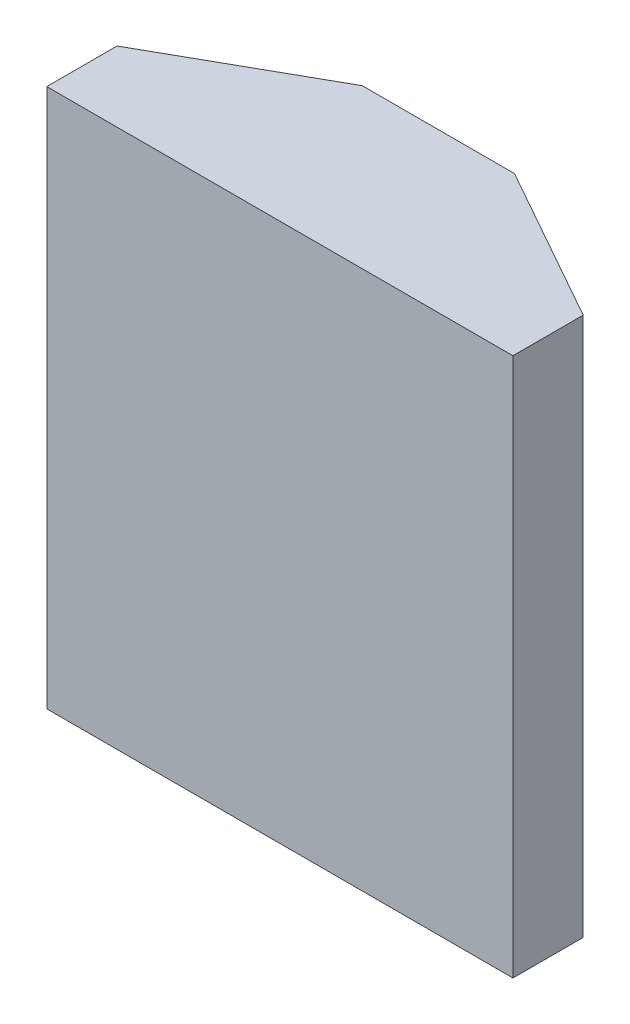
from build123d import *

# Parameters (mm, degrees)
BOSS_EXTRUDE1_DEPTH = 46
CUT_EXTRUDE1_START  = -1
CUT_EXTRUDE1_DEPTH  = 44
CUT_EXTRUDE2_REACH  = 53.912


with BuildPart() as part:
    # Sketch1 → Boss-Extrude1 (new body)
    with BuildSketch(Plane(origin=(0, 0, 0), x_dir=(1, 0, 0), z_dir=(0, 1, 0))):
        Polygon((-19.895, 0), (19.895, 0), (19.895, 6), (6.5, 13.53), (-6.5, 13.53), (-19.895, 6), align=None)
    extrude(amount=BOSS_EXTRUDE1_DEPTH)

    # Sketch2 → Cut-Extrude1 (cut)
    with BuildSketch(Plane(origin=(0, 46, 0), x_dir=(1, 0, 0), z_dir=(0, 1, 0)).offset(CUT_EXTRUDE1_START)):
        Polygon((18.895, 5.414974095), (6.23819097, 12.53), (-6.23819097, 12.53), (-18.895, 5.414974095), (-18.895, 1), (18.895, 1), align=None)
    extrude(amount=-CUT_EXTRUDE1_DEPTH, mode=Mode.SUBTRACT)

    # Sketch3 → Cut-Extrude2 (cut, up to next)
    with BuildSketch(Plane.XZ, mode=Mode.PRIVATE) as cut_extrude2_sk1:
        with BuildLine():
            Line((-2.89, -9.97), (2.89, -9.97))
            ThreePointArc((2.89, -9.97), (4.17, -11.25), (2.89, -12.53))
            Line((2.89, -12.53), (-2.89, -12.53))
            ThreePointArc((-2.89, -12.53), (-4.17, -11.25), (-2.89, -9.97))
        make_face()
    cut_extrude2_tool1 = extrude(cut_extrude2_sk1.sketch, amount=-CUT_EXTRUDE2_REACH, mode=Mode.PRIVATE) & part.part
    add(cut_extrude2_tool1.solids().sort_by_distance((0, 0, -11.25))[0], mode=Mode.SUBTRACT)


solid = part.part
